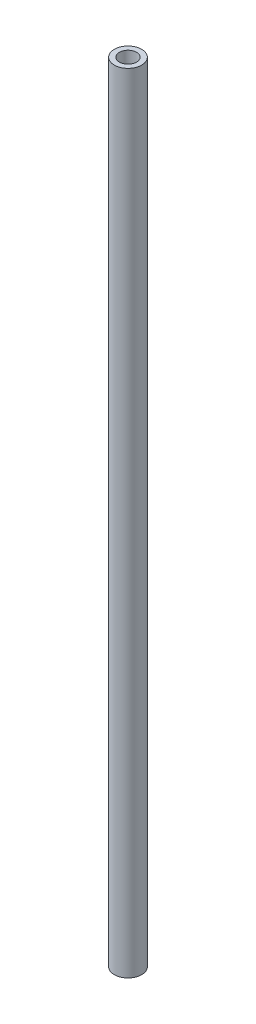
from build123d import *

# Parameters (mm, degrees)
SZKIC1_R                    = 4
SZKIC1_R_2                  = 2.5
DODANIE_WYCI_GNI_CIE1_DEPTH = 230


with BuildPart() as part:
    # Szkic1 → Dodanie-wyciągnięcie1 (new body)
    with BuildSketch(Plane(origin=(0, 0, 0), x_dir=(1, 0, 0), z_dir=(0, 1, 0))):
        with Locations(Location((0, 0, 0), (0, 0, 270))):
            Circle(SZKIC1_R)
        with Locations(Location((0, 0, 0), (0, 0, 270))):
            Circle(SZKIC1_R_2, mode=Mode.SUBTRACT)
    extrude(amount=DODANIE_WYCI_GNI_CIE1_DEPTH)


solid = part.part
